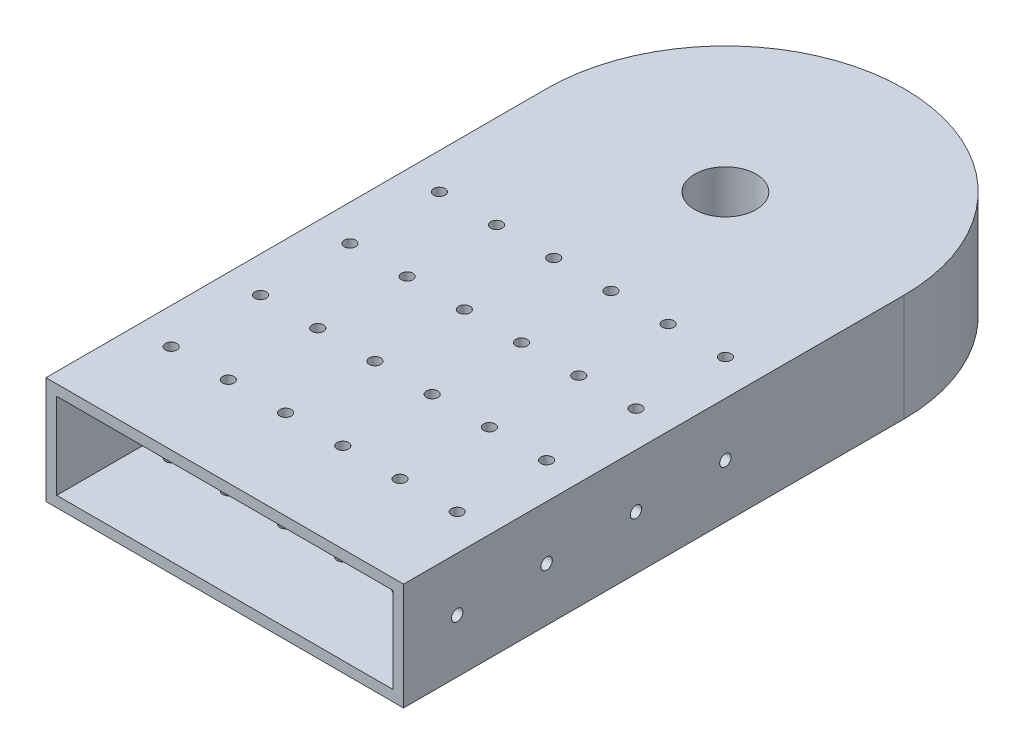
from build123d import *

# Parameters (mm, degrees)
SKETCH1_R           = 8.6
BOSS_EXTRUDE1_DEPTH = 30
SHELL1_T            = -3
SKETCH2_R           = 1.6
CUT_EXTRUDE1_DEPTH  = 143
SKETCH3_R           = 1.6
CUT_EXTRUDE2_DEPTH  = 47


with BuildPart() as part:
    # Sketch1 → Boss-Extrude1 (new body)
    with BuildSketch(Plane(origin=(0, 0, 0), x_dir=(1, 0, 0), z_dir=(0, 1, 0))):
        with BuildLine():
            Line((-50, 0), (-50, -140))
            Line((-50, -140), (50, -140))
            Line((50, -140), (50, 0))
            ThreePointArc((50, 0), (0, 50), (-50, 0))
        make_face()
        with Locations(Location((0, 0, 0), (0, 0, 270))):
            Circle(SKETCH1_R, mode=Mode.SUBTRACT)
    extrude(amount=BOSS_EXTRUDE1_DEPTH)

    # Shell1
    shell1_openings = [part.faces().sort_by_distance(p)[0] for p in [
        (0, 15, 140),
    ]]
    offset(amount=SHELL1_T, openings=shell1_openings, kind=Kind.INTERSECTION)

    # Sketch2 → Cut-Extrude1 (cut)
    with BuildSketch(Plane(origin=(50, 0, 0), x_dir=(0, 0, -1), z_dir=(1, 0, 0))):
        with Locations((-125, 15)):
            Circle(SKETCH2_R)
        with Locations((-100, 15)):
            Circle(SKETCH2_R)
        with Locations((-75, 15)):
            Circle(SKETCH2_R)
        with Locations((-50, 15)):
            Circle(SKETCH2_R)
    extrude(amount=-CUT_EXTRUDE1_DEPTH, mode=Mode.SUBTRACT)

    # Sketch3 → Cut-Extrude2 (cut)
    with BuildSketch(Plane(origin=(0, 30, 0), x_dir=(1, 0, 0), z_dir=(0, 1, 0))):
        with Locations(Location((-40, -115, 0), (0, 0, 270))):
            Circle(SKETCH3_R)
        with Locations(Location((-24, -115, 0), (0, 0, 270))):
            Circle(SKETCH3_R)
        with Locations(Location((-8, -115, 0), (0, 0, 270))):
            Circle(SKETCH3_R)
        with Locations(Location((8, -115, 0), (0, 0, 270))):
            Circle(SKETCH3_R)
        with Locations(Location((24, -115, 0), (0, 0, 270))):
            Circle(SKETCH3_R)
        with Locations(Location((40, -115, 0), (0, 0, 270))):
            Circle(SKETCH3_R)
        with Locations(Location((-40, -90, 0), (0, 0, 270))):
            Circle(SKETCH3_R)
        with Locations(Location((-24, -90, 0), (0, 0, 270))):
            Circle(SKETCH3_R)
        with Locations(Location((-8, -90, 0), (0, 0, 270))):
            Circle(SKETCH3_R)
        with Locations(Location((8, -90, 0), (0, 0, 270))):
            Circle(SKETCH3_R)
        with Locations(Location((24, -90, 0), (0, 0, 270))):
            Circle(SKETCH3_R)
        with Locations(Location((40, -90, 0), (0, 0, 270))):
            Circle(SKETCH3_R)
        with Locations(Location((-40, -65, 0), (0, 0, 270))):
            Circle(SKETCH3_R)
        with Locations(Location((-24, -65, 0), (0, 0, 270))):
            Circle(SKETCH3_R)
        with Locations(Location((-8, -65, 0), (0, 0, 270))):
            Circle(SKETCH3_R)
        with Locations(Location((8, -65, 0), (0, 0, 270))):
            Circle(SKETCH3_R)
        with Locations(Location((24, -65, 0), (0, 0, 270))):
            Circle(SKETCH3_R)
        with Locations(Location((40, -65, 0), (0, 0, 270))):
            Circle(SKETCH3_R)
        with Locations(Location((-40, -40, 0), (0, 0, 270))):
            Circle(SKETCH3_R)
        with Locations(Location((-24, -40, 0), (0, 0, 270))):
            Circle(SKETCH3_R)
        with Locations(Location((-8, -40, 0), (0, 0, 270))):
            Circle(SKETCH3_R)
        with Locations(Location((8, -40, 0), (0, 0, 270))):
            Circle(SKETCH3_R)
        with Locations(Location((24, -40, 0), (0, 0, 270))):
            Circle(SKETCH3_R)
        with Locations(Location((40, -40, 0), (0, 0, 270))):
            Circle(SKETCH3_R)
    extrude(amount=-CUT_EXTRUDE2_DEPTH, mode=Mode.SUBTRACT)


solid = part.part
